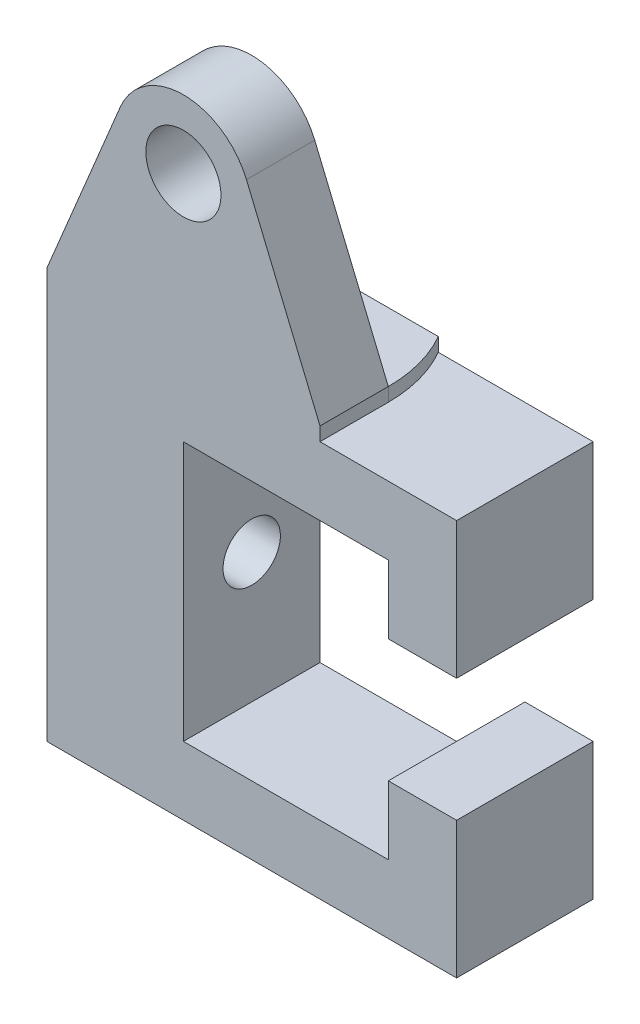
from build123d import *

# Parameters (mm, degrees)
BOSS_EXTRUDE1_DEPTH = 5
SKETCH2_R           = 2.1
CUT_EXTRUDE1_DEPTH  = 10
SKETCH3_R           = 10
BOSS_EXTRUDE2_DEPTH = 1
SKETCH4_R           = 2.75
BOSS_EXTRUDE3_DEPTH = 5
SKETCH5_W           = 50
SKETCH5_H           = 30
SKETCH5_W_2         = 30
SKETCH5_H_2         = 10
CUT_EXTRUDE2_DEPTH  = 52.14684741
BOSS_EXTRUDE4_START = 1
BOSS_EXTRUDE4_DEPTH = 1


with BuildPart() as part:
    # Sketch1 → Boss-Extrude1 (new, symmetric)
    with BuildSketch(Plane.XY):
        Polygon((15, 5), (15, 0), (0, 0), (0, 19), (15, 19), (15, 14), (20, 14), (20, 24), (-10, 24), (-10, -5), (20, -5), (20, 5), align=None)
    extrude(amount=BOSS_EXTRUDE1_DEPTH, both=True)

    # Sketch2 → Cut-Extrude1 (cut)
    with BuildSketch(Plane.ZY.offset(10)):
        with Locations(Location((0, 9.5, 0), (0, 0, 270))):
            Circle(SKETCH2_R)
    extrude(amount=-CUT_EXTRUDE1_DEPTH, mode=Mode.SUBTRACT)

    # Sketch3 → Boss-Extrude2 (add)
    with BuildSketch(Plane(origin=(0, 24, 0), x_dir=(1, 0, 0), z_dir=(0, 1, 0))):
        with Locations(Location((0, 0, 0), (0, 0, 180))):
            Circle(SKETCH3_R)
    extrude(amount=BOSS_EXTRUDE2_DEPTH)

    # Sketch4 → Boss-Extrude3 (add)
    with BuildSketch(Plane.XY):
        with BuildLine():
            Line((10, 25), (-10, 25))
            Line((-10, 25), (-4.615384615, 37.923076923))
            ThreePointArc((-4.615384615, 37.923076923), (0, 41), (4.615384615, 37.923076923))
            Line((4.615384615, 37.923076923), (10, 25))
        make_face()
        with Locations((0, 36)):
            Circle(SKETCH4_R, mode=Mode.SUBTRACT)
    extrude(amount=BOSS_EXTRUDE3_DEPTH)

    # Sketch5 → Cut-Extrude2 (cut, through all)
    with BuildSketch(Plane.XZ.offset(5)):
        with Locations((5, 0)):
            Rectangle(SKETCH5_W, SKETCH5_H)
        with Locations((5, 0)):
            Rectangle(SKETCH5_W_2, SKETCH5_H_2, mode=Mode.SUBTRACT)
    extrude(amount=-CUT_EXTRUDE2_DEPTH, mode=Mode.SUBTRACT)

    # Sketch6 → Boss-Extrude4 (add)
    with BuildSketch(Plane.XZ.offset(-25).offset(BOSS_EXTRUDE4_START)):
        with BuildLine():
            Line((10, 5), (8.660254038, 5))
            ThreePointArc((8.660254038, 5), (9.659258263, 2.588190451), (10, 0))
            Line((10, 0), (10, 5))
        make_face()
        with BuildLine():
            Line((-10, 5), (-10, 0))
            ThreePointArc((-10, 0), (-9.659258263, 2.588190451), (-8.660254038, 5))
            Line((-8.660254038, 5), (-10, 5))
        make_face()
    extrude(amount=-BOSS_EXTRUDE4_DEPTH)


solid = part.part
